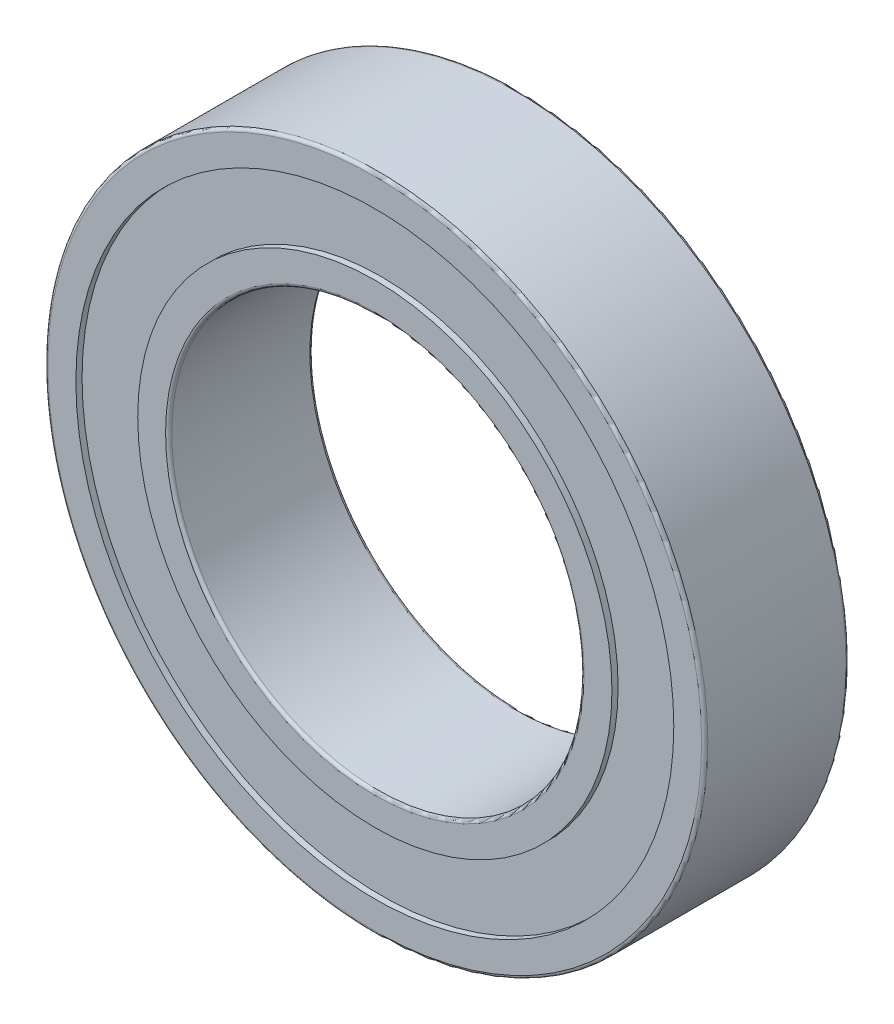
from build123d import *

# Parameters (mm, degrees)
SKETCH1_R           = 16
SKETCH1_R_2         = 10
BOSS_EXTRUDE1_DEPTH = 7
SKETCH2_R           = 14.5
SKETCH2_R_2         = 11.5
CUT_EXTRUDE1_DEPTH  = 0.3
CUT_EXTRUDE2_START  = -6.5
SKETCH2_2_R         = 14.5
SKETCH2_2_R_2       = 11.5
CUT_EXTRUDE2_DEPTH  = 0.5
FILLET1_R           = 0.15


with BuildPart() as part:
    # Sketch1 → Boss-Extrude1 (new body)
    with BuildSketch(Plane.XY):
        Circle(SKETCH1_R)
        Circle(SKETCH1_R_2, mode=Mode.SUBTRACT)
    extrude(amount=BOSS_EXTRUDE1_DEPTH)

    # Sketch2 → Cut-Extrude1 (cut)
    with BuildSketch(Plane.XY.offset(7)):
        Circle(SKETCH2_R)
        Circle(SKETCH2_R_2, mode=Mode.SUBTRACT)
    extrude(amount=-CUT_EXTRUDE1_DEPTH, mode=Mode.SUBTRACT)

    # Sketch2<2> → Cut-Extrude2 (cut)
    with BuildSketch(Plane.XY.offset(7).offset(CUT_EXTRUDE2_START)):
        Circle(SKETCH2_2_R)
        Circle(SKETCH2_2_R_2, mode=Mode.SUBTRACT)
    extrude(amount=-CUT_EXTRUDE2_DEPTH, mode=Mode.SUBTRACT)

    # Fillet1
    fillet1_edges = [part.edges().sort_by_distance(p)[0] for p in [
        (-16, 0, 0),
        (-16, 0, 7),
        (-10, 0, 0),
        (-10, 0, 7),
    ]]
    fillet(fillet1_edges, radius=FILLET1_R)


solid = part.part
